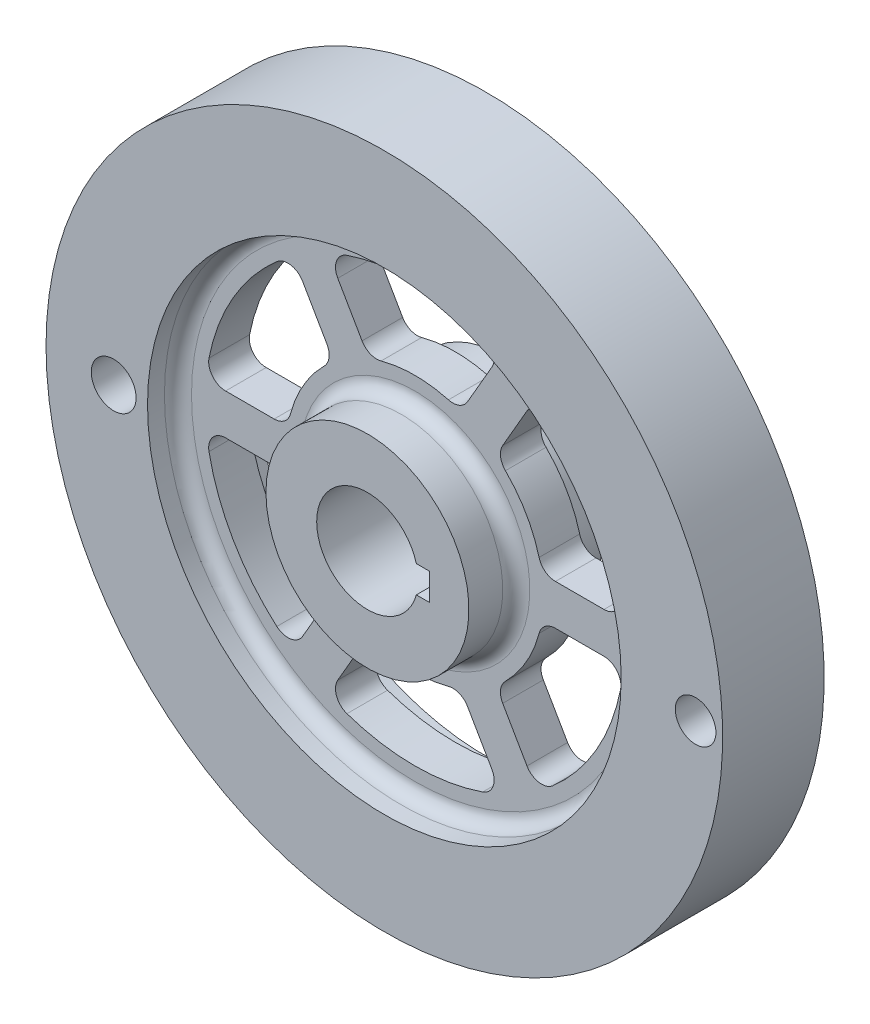
from build123d import *

# Parameters (mm, degrees)
FILLET_1_R               = 4
CUT_EXTRUDE_3_DEPTH      = 6
PATTERN_CIRCULAR_2_COUNT = 6
SKETCH_5_W               = 18.3
SKETCH_5_H               = 8
CUT_EXTRUDE_4_DEPTH      = 20
SKETCH_6_R               = 6
CUT_EXTRUDE_5_DEPTH      = 146.688022843
SKETCH_7_R               = 6.6215
CUT_EXTRUDE_6_DEPTH      = 146.688022843


with BuildPart() as part:
    # 草图1 → 旋转1 (revolve)
    with BuildSketch(Plane(origin=(0, 0, 0), x_dir=(1, 0, 0), z_dir=(0, 1, 0))):
        Polygon((15, 20), (30, 20), (30, 6), (70, 6), (70, 15), (100, 15), (100, -15), (70, -15), (70, -6), (30, -6), (30, -20), (15, -20), align=None)
    revolve(axis=Axis((0, 0, -20), (0, 0, 1)))

    # 圆角1
    fillet_1_edges = [part.edges().sort_by_distance(p)[0] for p in [
        (-70, 0, -6),
        (-70, 0, 6),
        (-30, 0, -6),
        (-30, 0, 6),
    ]]
    fillet(fillet_1_edges, radius=FILLET_1_R)

    # 草图4 → 切除-拉伸3 (cut, symmetric)
    with BuildSketch(Plane.XY):
        with BuildLine():
            Line((41.5692, 6), (55.9285, 6))
            ThreePointArc((55.9285, 6), (59.790137098, 7.823876746), (60.8345, 11.9649))
            ThreePointArc((60.8345, 11.9649), (53.693292616, 30.999275079), (40.779, 46.7004))
            ThreePointArc((40.779, 46.7004), (36.670623538, 47.866536224), (33.1603, 45.4342))
            Line((33.1603, 45.4342), (25.9807, 32.9996))
            ThreePointArc((25.9807, 32.9996), (25.354603735, 29.839289607), (26.7862, 26.9531))
            ThreePointArc((26.7862, 26.9531), (32.908684734, 18.999699449), (36.7356, 9.7209))
            ThreePointArc((36.7356, 9.7209), (38.519259186, 7.037974406), (41.5692, 6))
        make_face()
    cut_extrude_3 = extrude(amount=CUT_EXTRUDE_3_DEPTH, both=True, mode=Mode.SUBTRACT)

    # 阵列(圆周)2: 切除-拉伸3 ×6 about axis
    pattern_circular_2_axis = Axis((0, 0, 22), (0, 0, -1))
    for i in range(1, PATTERN_CIRCULAR_2_COUNT):
        add(cut_extrude_3.rotate(pattern_circular_2_axis, i * 360 / PATTERN_CIRCULAR_2_COUNT), mode=Mode.SUBTRACT)

    # 草图5 → 切除-拉伸4 (cut, symmetric)
    with BuildSketch(Plane.XY):
        with Locations((9.15, 0)):
            Rectangle(SKETCH_5_W, SKETCH_5_H)
    extrude(amount=CUT_EXTRUDE_4_DEPTH, both=True, mode=Mode.SUBTRACT)

    # 草图6 → 切除-拉伸5 (cut, through all)
    with BuildSketch(Plane.XY.offset(15)):
        with Locations((92, 0)):
            Circle(SKETCH_6_R)
    extrude(amount=-CUT_EXTRUDE_5_DEPTH, mode=Mode.SUBTRACT)

    # 草图7 → 切除-拉伸6 (cut, through all)
    with BuildSketch(Plane.XY.offset(15)):
        with Locations((-80, 0)):
            Circle(SKETCH_7_R)
    extrude(amount=-CUT_EXTRUDE_6_DEPTH, mode=Mode.SUBTRACT)


solid = part.part
